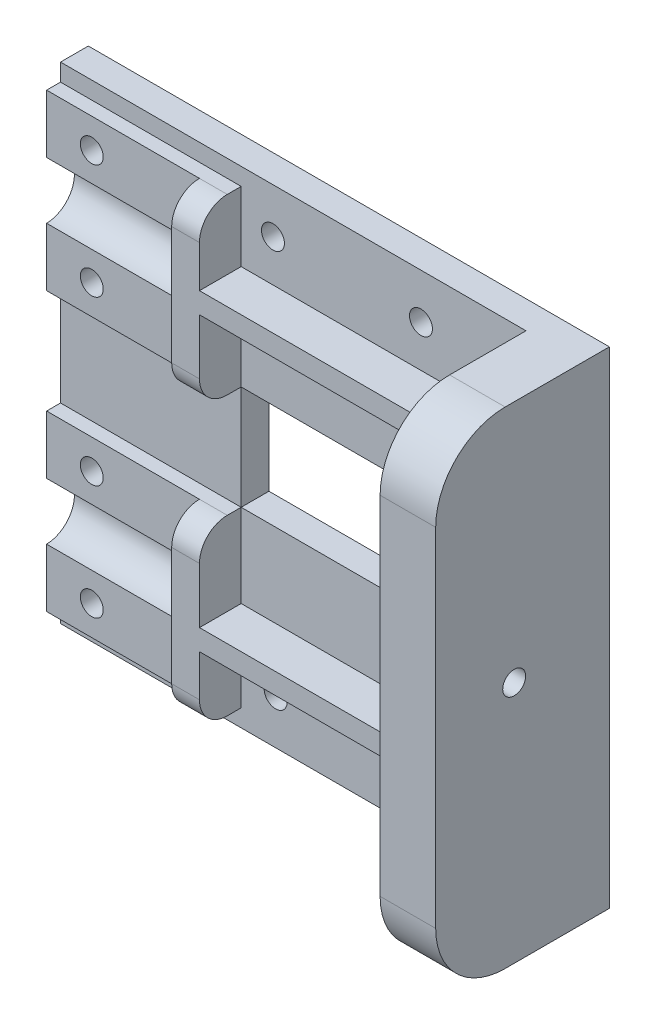
from build123d import *

# Parameters (mm, degrees)
SKETCH1_W               = 75
SKETCH1_H               = 70
BOSS_EXTRUDE1_DEPTH     = 4
SKETCH4_W               = 26
SKETCH4_H               = 25
BOSS_EXTRUDE2_DEPTH     = 2
SKETCH3_R               = 4.1
CUT_EXTRUDE1_DEPTH      = 22
SKETCH5_W               = 40
SKETCH5_H               = 45
BOSS_EXTRUDE3_DEPTH     = 4
SKETCH7_R               = 11.3
SKETCH7_R_2             = 1.5
CUT_EXTRUDE2_DEPTH      = 86.248167136
SKETCH8_W               = 4
SKETCH8_H               = 25
BOSS_EXTRUDE4_DEPTH     = 4
FILLET2_R               = 4
SKETCH10_W              = 89
SKETCH10_H              = 3
BOSS_EXTRUDE5_DEPTH     = 6
CHAMFER2_SIZE           = 4
FILLET3_R               = 1
SKETCH11_W              = 40
SKETCH11_H              = 53
CUT_EXTRUDE3_DEPTH      = 86.622718948
SKETCH13_W              = 25
SKETCH13_H              = 70
BOSS_EXTRUDE6_DEPTH     = 8
SKETCH14_W              = 41
SKETCH14_H              = 15
CUT_EXTRUDE4_DEPTH      = 56.427881071
FILLET4_R               = 10
SKETCH15_R              = 1.65
CUT_EXTRUDE5_DEPTH      = 10
CUT_EXTRUDE6_DEPTH      = 58.063561053
CUT_EXTRUDE6_DEPTH_BACK = 58.063561053
SKETCH16_R              = 1.65


with BuildPart() as part:
    # Sketch1 → Boss-Extrude1 (new body)
    with BuildSketch(Plane.XY):
        Rectangle(SKETCH1_W, SKETCH1_H)
    extrude(amount=BOSS_EXTRUDE1_DEPTH)

    # Sketch4 → Boss-Extrude2 (add)
    with BuildSketch(Plane.XY.offset(4)):
        with Locations((-24.5, 20)):
            Rectangle(SKETCH4_W, SKETCH4_H)
        with Locations((-24.5, -20)):
            Rectangle(SKETCH4_W, SKETCH4_H)
    extrude(amount=BOSS_EXTRUDE2_DEPTH)

    # Sketch3 → Cut-Extrude1 (cut)
    with BuildSketch(Plane.ZY.offset(37.5)):
        with Locations((6.1, 20)):
            Circle(SKETCH3_R)
        with Locations((6.1, -20)):
            Circle(SKETCH3_R)
    extrude(amount=-CUT_EXTRUDE1_DEPTH, mode=Mode.SUBTRACT)

    # Sketch5 → Boss-Extrude3 (add)
    with BuildSketch(Plane.XY.offset(4)):
        with Locations((57.5, 0)):
            Rectangle(SKETCH5_W, SKETCH5_H)
    extrude(amount=-BOSS_EXTRUDE3_DEPTH)

    # Sketch7 → Cut-Extrude2 (cut, through all)
    with BuildSketch(Plane(origin=(0, 0, 0), x_dir=(-1, 0, 0), z_dir=(0, 0, -1))):
        with Locations((-54.5, 0)):
            Circle(SKETCH7_R)
        with Locations((-70, 15.5)):
            Circle(SKETCH7_R_2)
        with Locations((-39, 15.5)):
            Circle(SKETCH7_R_2)
        with Locations((-39, -15.5)):
            Circle(SKETCH7_R_2)
        with Locations((-70, -15.5)):
            Circle(SKETCH7_R_2)
    extrude(amount=-CUT_EXTRUDE2_DEPTH, mode=Mode.SUBTRACT)

    # Sketch8 → Boss-Extrude4 (add)
    with BuildSketch(Plane.XY.offset(6)):
        with Locations((-13.5, 20)):
            Rectangle(SKETCH8_W, SKETCH8_H)
        with Locations((-13.5, -20)):
            Rectangle(SKETCH8_W, SKETCH8_H)
    extrude(amount=BOSS_EXTRUDE4_DEPTH)

    # Fillet2
    fillet2_edges = [part.edges().sort_by_distance(p)[0] for p in [
        (-13.5, -32.5, 10),
        (-13.5, -7.5, 10),
        (-13.5, 32.5, 10),
        (-13.5, 7.5, 10),
    ]]
    fillet(fillet2_edges, radius=FILLET2_R)

    # Sketch10 → Boss-Extrude5 (add)
    with BuildSketch(Plane.XY.offset(4)):
        with Locations((33, 21)):
            Rectangle(SKETCH10_W, SKETCH10_H)
        with Locations((33, -21)):
            Rectangle(SKETCH10_W, SKETCH10_H)
    extrude(amount=BOSS_EXTRUDE5_DEPTH)

    # Chamfer2
    chamfer2_edges = [part.edges().sort_by_distance(p)[0] for p in [
        (37.5, 22.5, 2),
        (37.5, -22.5, 2),
        (77.5, 22.5, 5),
        (77.5, -22.5, 5),
    ]]
    chamfer(chamfer2_edges, length=CHAMFER2_SIZE)

    # Fillet3
    fillet3_edges = [part.edges().sort_by_distance(p)[0] for p in [
        (76.5, 19.5, 7),
        (76.5, -19.5, 7),
    ]]
    fillet(fillet3_edges, radius=FILLET3_R)

    # Sketch11 → Cut-Extrude3 (cut, through all)
    with BuildSketch(Plane(origin=(0, 0, 0), x_dir=(-1, 0, 0), z_dir=(0, 0, -1))):
        with Locations((-57.5, 0)):
            Rectangle(SKETCH11_W, SKETCH11_H)
    extrude(amount=-CUT_EXTRUDE3_DEPTH, mode=Mode.SUBTRACT)

    # Sketch13 → Boss-Extrude6 (add)
    with BuildSketch(Plane(origin=(37.5, 0, 0), x_dir=(0, 0, -1), z_dir=(1, 0, 0))):
        with Locations((-12.5, 0)):
            Rectangle(SKETCH13_W, SKETCH13_H)
    extrude(amount=-BOSS_EXTRUDE6_DEPTH)

    # Sketch14 → Cut-Extrude4 (cut, through all)
    with BuildSketch(Plane.XY.offset(4)):
        with Locations((9, 0)):
            Rectangle(SKETCH14_W, SKETCH14_H)
    extrude(amount=-CUT_EXTRUDE4_DEPTH, mode=Mode.SUBTRACT)

    # Fillet4
    fillet4_edges = [part.edges().sort_by_distance(p)[0] for p in [
        (33.5, -35, 25),
        (33.5, 35, 25),
    ]]
    fillet(fillet4_edges, radius=FILLET4_R)

    # Sketch15 → Cut-Extrude5 (cut)
    with BuildSketch(Plane(origin=(37.5, 0, 0), x_dir=(0, 0, -1), z_dir=(1, 0, 0))):
        with Locations(Location((-13.7, 0, 0), (0, 0, 90))):
            Circle(SKETCH15_R)
    extrude(amount=-CUT_EXTRUDE5_DEPTH, mode=Mode.SUBTRACT)

    # Sketch16 → Cut-Extrude6 (cut, two sides: drawn at the far end of the back side and taken through both)
    with BuildSketch(Plane(origin=(0, 0, 0), x_dir=(-1, 0, 0), z_dir=(0, 0, -1)).offset(-CUT_EXTRUDE6_DEPTH_BACK)):
        with Locations((31, 28.238089535)):
            Circle(SKETCH16_R)
        with Locations((31, 11.761910465)):
            Circle(SKETCH16_R)
        with Locations(Location((31, -11.761910465, 0), (0, 0, 180))):
            Circle(SKETCH16_R)
        with Locations(Location((31, -28.238089535, 0), (0, 0, 180))):
            Circle(SKETCH16_R)
        with Locations(Location((-14.38196164, 28.5, 0), (0, 0, 180))):
            Circle(SKETCH16_R)
        with Locations(Location((6.92196164, 28.5, 0), (0, 0, 180))):
            Circle(SKETCH16_R)
        with Locations(Location((-13.99696164, -28.5, 0), (0, 0, 180))):
            Circle(SKETCH16_R)
        with Locations(Location((6.53696164, -28.5, 0), (0, 0, 180))):
            Circle(SKETCH16_R)
    extrude(amount=CUT_EXTRUDE6_DEPTH + CUT_EXTRUDE6_DEPTH_BACK, mode=Mode.SUBTRACT)


solid = part.part
